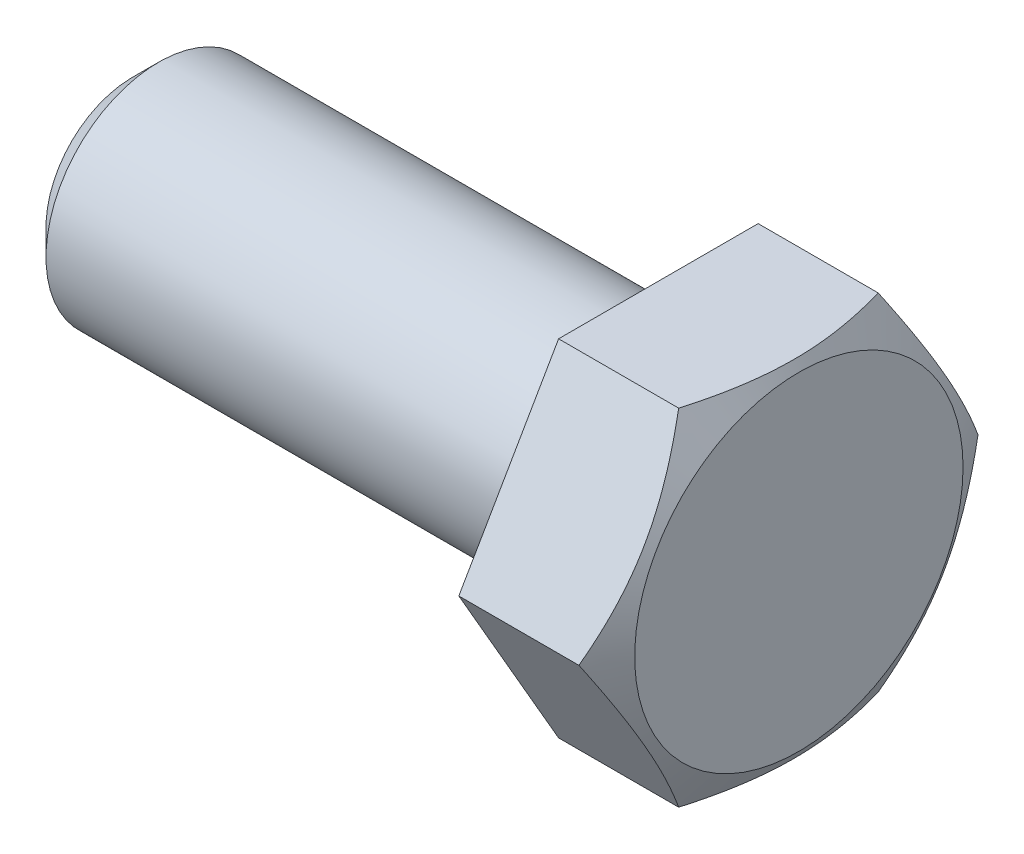
from build123d import *

# Parameters (mm, degrees)
EXTRUDE_565_DEPTH = 18.7
SKETCH_2_R        = 15
EXTRUDE_1_DEPTH   = 70
CHAMFER_1_SIZE    = 3.5


with BuildPart() as part:
    # Эскиз1 → Extrude 565 (new body)
    with BuildSketch(Plane(origin=(0, 0, 0), x_dir=(0, 0, -1), z_dir=(1, 0, 0))):
        Polygon((26.558112383, 0), (13.279056191, 23), (-13.279056191, 23), (-26.558112383, 0), (-13.279056191, -23), (13.279056191, -23), align=None)
    extrude(amount=EXTRUDE_565_DEPTH)

    # Эскиз2 → Бобышка-Вытянуть1 (add)
    with BuildSketch(Plane.ZY):
        Circle(SKETCH_2_R)
    extrude(amount=EXTRUDE_1_DEPTH)

    # Фаска1
    chamfer_1_edges = [part.edges().sort_by_distance(p)[0] for p in [
        (-70, 0, -15),
    ]]
    chamfer(chamfer_1_edges, length=CHAMFER_1_SIZE)

    # Эскиз3 (on Front Plane) → Вырез-Вращением1 (revolve, cut)
    with BuildSketch(Plane.XY, mode=Mode.PRIVATE) as cut_revolve_1_sk:
        Polygon((18.7, 26.558112383), (18.7, 21.85), (15.981770048, 26.558112383), align=None)
    revolve(cut_revolve_1_sk.sketch.rotate(Axis((22, 0, 0), (-1, 0, 0)), 90), axis=Axis((22, 0, 0), (-1, 0, 0)), mode=Mode.SUBTRACT)


solid = part.part
